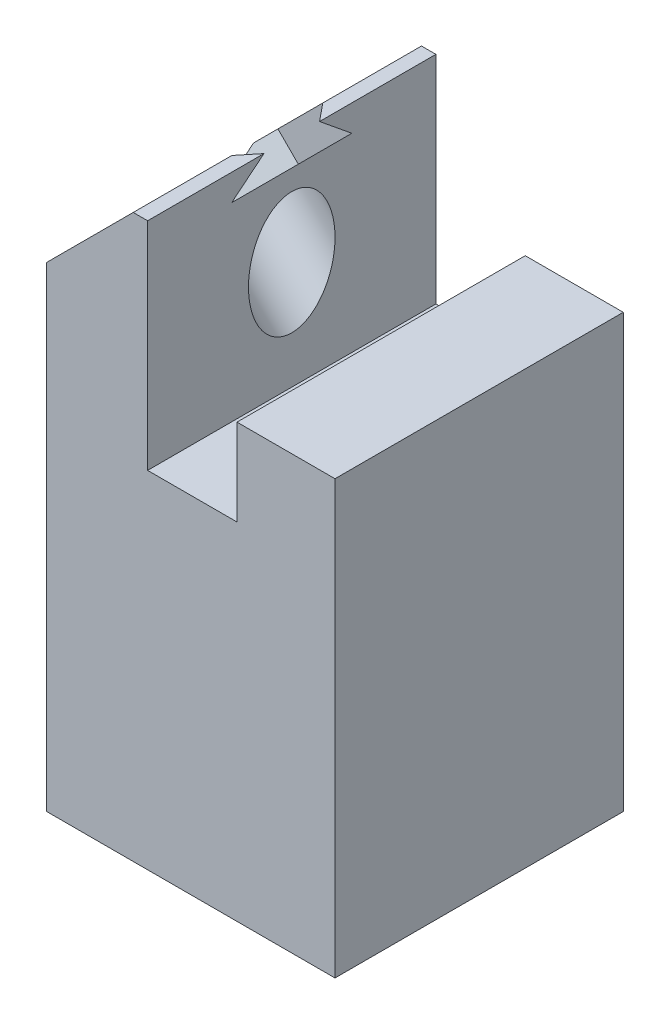
from build123d import *

# Parameters (mm, degrees)
SKETCH1_W           = 20
SKETCH1_H           = 20
BOSS_EXTRUDE1_DEPTH = 6
SKETCH2_W           = 6.8
SKETCH2_H           = 20
BOSS_EXTRUDE2_DEPTH = 6
SKETCH3_W           = 7
SKETCH3_H           = 20
BOSS_EXTRUDE3_DEPTH = 15
CHAMFER1_SIZE       = 6
SKETCH4_R           = 3
CUT_EXTRUDE1_DEPTH  = 10
SKETCH5_W           = 20
SKETCH5_H           = 20
BOSS_EXTRUDE4_DEPTH = 18
CUT_EXTRUDE2_DEPTH  = 2
SKETCH7_R           = 2.8
CUT_EXTRUDE3_DEPTH  = 20
CUT_EXTRUDE4_DEPTH  = 6


with BuildPart() as part:
    # Sketch1 → Boss-Extrude1 (new body)
    with BuildSketch(Plane(origin=(0, 0, 0), x_dir=(1, 0, 0), z_dir=(0, 1, 0))):
        Rectangle(SKETCH1_W, SKETCH1_H)
    extrude(amount=BOSS_EXTRUDE1_DEPTH)

    # Sketch2 → Boss-Extrude2 (add)
    with BuildSketch(Plane(origin=(0, 6, 0), x_dir=(1, 0, 0), z_dir=(0, 1, 0))):
        with Locations((6.6, 0)):
            Rectangle(SKETCH2_W, SKETCH2_H)
    extrude(amount=BOSS_EXTRUDE2_DEPTH)

    # Sketch3 → Boss-Extrude3 (add)
    with BuildSketch(Plane(origin=(0, 6, 0), x_dir=(1, 0, 0), z_dir=(0, 1, 0))):
        with Locations((-6.5, 0)):
            Rectangle(SKETCH3_W, SKETCH3_H)
    extrude(amount=BOSS_EXTRUDE3_DEPTH)

    # Chamfer1
    chamfer1_edges = [part.edges().sort_by_distance(p)[0] for p in [
        (-10, 21, 0),
    ]]
    chamfer(chamfer1_edges, length=CHAMFER1_SIZE)

    # Sketch4 → Cut-Extrude1 (cut)
    with BuildSketch(Plane(origin=(-12.5, 12.5, 0), x_dir=(0, 0, 1), z_dir=(-0.7071067811865489, 0.7071067811865462, 0))):
        with Locations(Location((0, 7.432512212, 0), (0, 0, 270))):
            Circle(SKETCH4_R)
    extrude(amount=-CUT_EXTRUDE1_DEPTH, mode=Mode.SUBTRACT)

    # Sketch5 → Boss-Extrude4 (add)
    with BuildSketch(Plane.XZ):
        Rectangle(SKETCH5_W, SKETCH5_H)
    extrude(amount=BOSS_EXTRUDE4_DEPTH)

    # Sketch6 → Cut-Extrude2 (cut)
    with BuildSketch(Plane(origin=(-12.5, 12.5, 0), x_dir=(0, 0, 1), z_dir=(-0.7071067811865489, 0.7071067811865462, 0))):
        Polygon((0, 13.8411002), (-5.55, 10.636806206), (-5.55, 4.228218218), (0, 1.023924224), (5.55, 4.228218218), (5.55, 10.636806206), align=None)
    extrude(amount=-CUT_EXTRUDE2_DEPTH, mode=Mode.SUBTRACT)

    # Sketch7 → Cut-Extrude3 (cut)
    with BuildSketch(Plane(origin=(0, -18, 0), x_dir=(-1, 0, 0), z_dir=(0, -1, 0))):
        with Locations(Location((0, 0, 0), (0, 0, 90))):
            Circle(SKETCH7_R)
    extrude(amount=-CUT_EXTRUDE3_DEPTH, mode=Mode.SUBTRACT)

    # Sketch8 → Cut-Extrude4 (cut)
    with BuildSketch(Plane(origin=(0, -18, 0), x_dir=(-1, 0, 0), z_dir=(0, -1, 0))):
        Polygon((5.038618856, -2.935243322), (5.061304711, 2.895950268), (0.022685855, 5.83119359), (-5.038618856, 2.935243322), (-5.061304711, -2.895950268), (-0.022685855, -5.83119359), align=None)
    extrude(amount=-CUT_EXTRUDE4_DEPTH, mode=Mode.SUBTRACT)


solid = part.part
